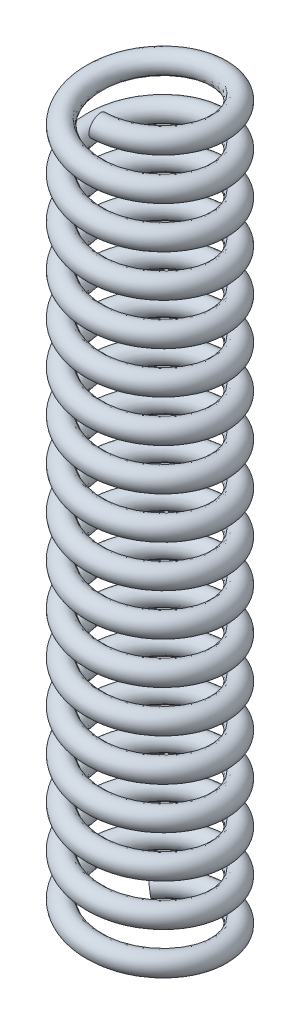
from build123d import *

# Parameters (mm, degrees)
SWEEP1_PITCH       = 1
SWEEP1_HEIGHT      = 17.6
SWEEP1_RADIUS      = 1.5
SWEEP1_START_ANGLE = -135
SWEEP1_PROFILE_R   = 0.25


with BuildPart() as part:
    # Sweep1: sweep along a helix
    with BuildLine() as sweep1_path:
        add(Helix(SWEEP1_PITCH, SWEEP1_HEIGHT, SWEEP1_RADIUS, center=(0, 0, 0), direction=(0, 1, 0), lefthand=True, mode=Mode.PRIVATE).rotate(Axis((0, 0, 0), (0, 1, 0)), SWEEP1_START_ANGLE))
    # Sweep1 profile (on start of the path) → Sweep1 (sweep)
    with BuildSketch(Plane(origin=(-1.060660172, 0, -1.060660172), x_dir=(-0.7071067811866238, 0, -0.7071067811864714), z_dir=(0.703159804126662, 0.1055110407535411, -0.7031598041268137))):
        Circle(SWEEP1_PROFILE_R)
    sweep(path=sweep1_path.line, is_frenet=True)


solid = part.part
